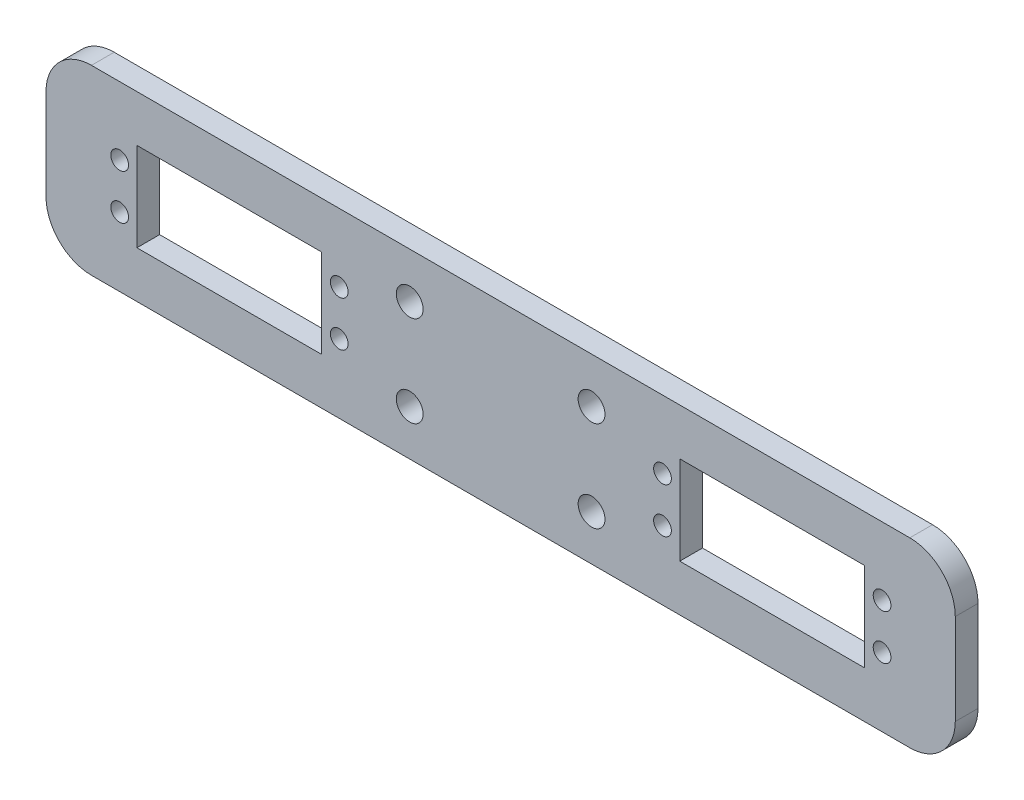
from build123d import *

# Parameters (mm, degrees)
CROQUIS1_W            = 200
CROQUIS1_H            = 40
EXTRUIR1_DEPTH        = 2.5
REDONDEO1_R           = 10
CROQUIS3_W            = 40.6
CROQUIS3_H            = 19.5
EXTRUIR2_DEPTH        = 10
CROQUIS4_R            = 1.95
CORTAR_EXTRUIR1_DEPTH = 10
CROQUIS5_R            = 2.95
CORTAR_EXTRUIR3_DEPTH = 10


with BuildPart() as part:
    # Croquis1 → Extruir1 (new, symmetric)
    with BuildSketch(Plane.XY):
        with Locations((-25, -5)):
            Rectangle(CROQUIS1_W, CROQUIS1_H)
    extrude(amount=EXTRUIR1_DEPTH, both=True)

    # Redondeo1
    redondeo1_edges = [part.edges().sort_by_distance(p)[0] for p in [
        (75, 15, 0),
        (75, -25, 0),
        (-125, -25, 0),
        (-125, 15, 0),
    ]]
    fillet(redondeo1_edges, radius=REDONDEO1_R)

    # Croquis3 → Extruir2 (cut)
    with BuildSketch(Plane.XY.offset(2.5)):
        with Locations((34.7, -5)):
            Rectangle(CROQUIS3_W, CROQUIS3_H)
        with Locations((-84.7, -5)):
            Rectangle(CROQUIS3_W, CROQUIS3_H)
    extrude(amount=-EXTRUIR2_DEPTH, mode=Mode.SUBTRACT)

    # Croquis4 → Cortar-Extruir1 (cut)
    with BuildSketch(Plane.XY.offset(2.5)):
        with Locations((58.9, -9.85)):
            Circle(CROQUIS4_R)
        with Locations((58.9, 0.05)):
            Circle(CROQUIS4_R)
        with Locations((10.6, 0.05)):
            Circle(CROQUIS4_R)
        with Locations((10.6, -9.85)):
            Circle(CROQUIS4_R)
        with Locations((-108.8, -9.85)):
            Circle(CROQUIS4_R)
        with Locations((-108.8, 0.05)):
            Circle(CROQUIS4_R)
        with Locations((-60.5, 0.05)):
            Circle(CROQUIS4_R)
        with Locations((-60.5, -9.85)):
            Circle(CROQUIS4_R)
    extrude(amount=-CORTAR_EXTRUIR1_DEPTH, mode=Mode.SUBTRACT)

    # Croquis5 → Cortar-Extruir3 (cut)
    with BuildSketch(Plane.XY.offset(2.5)):
        with Locations((-45, 5)):
            Circle(CROQUIS5_R)
        with Locations(Location((-45, -15, 0), (0, 0, 180))):
            Circle(CROQUIS5_R)
        with Locations((-5, -15)):
            Circle(CROQUIS5_R)
        with Locations(Location((-5, 5, 0), (0, 0, 180))):
            Circle(CROQUIS5_R)
    extrude(amount=-CORTAR_EXTRUIR3_DEPTH, mode=Mode.SUBTRACT)


solid = part.part
